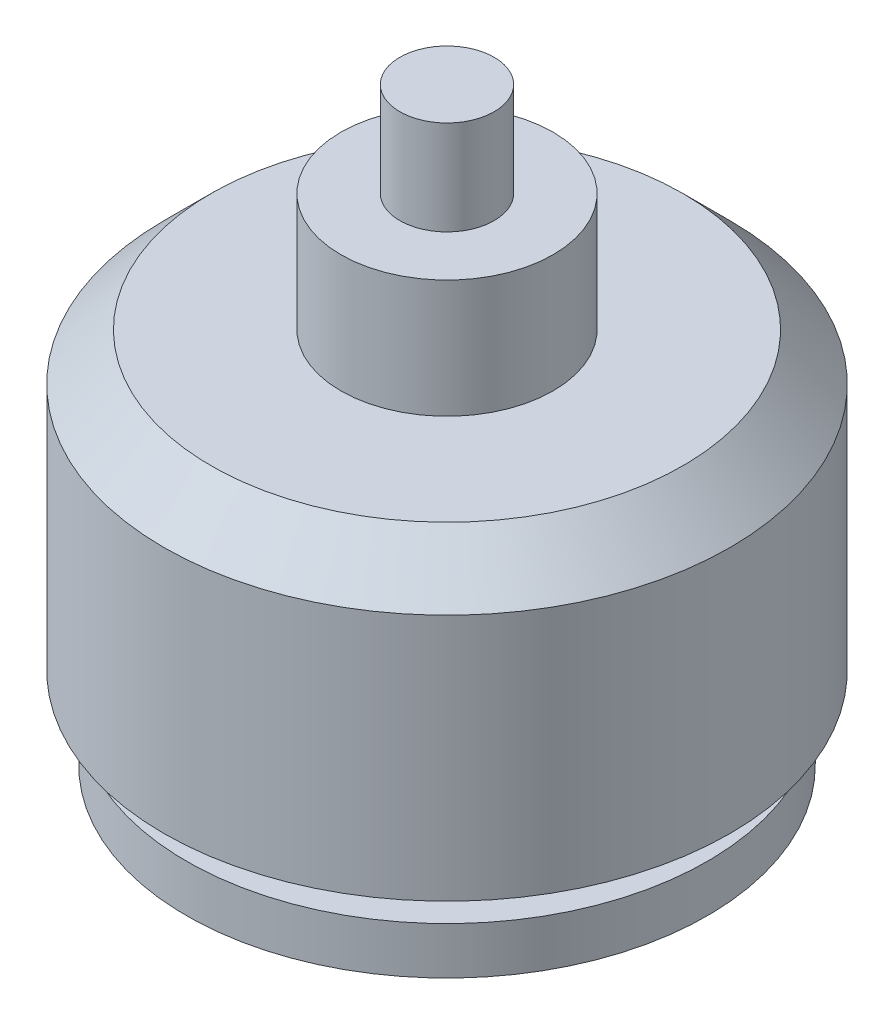
from build123d import *


with BuildPart() as part:
    # Sketch1 → Revolve1 (revolve)
    with BuildSketch(Plane.XY, mode=Mode.PRIVATE) as revolve1_sk:
        Polygon((0, 0), (22.08, 0), (22.08, 4), (16.8, 4), (16.8, 7), (24, 7), (24, 28), (20, 32), (9, 32), (9, 42), (4, 42), (4, 50), (0, 50), align=None)
    revolve(revolve1_sk.sketch.rotate(Axis((0, -10, 0), (0, 1, 0)), 90), axis=Axis((0, -10, 0), (0, 1, 0)))


solid = part.part
